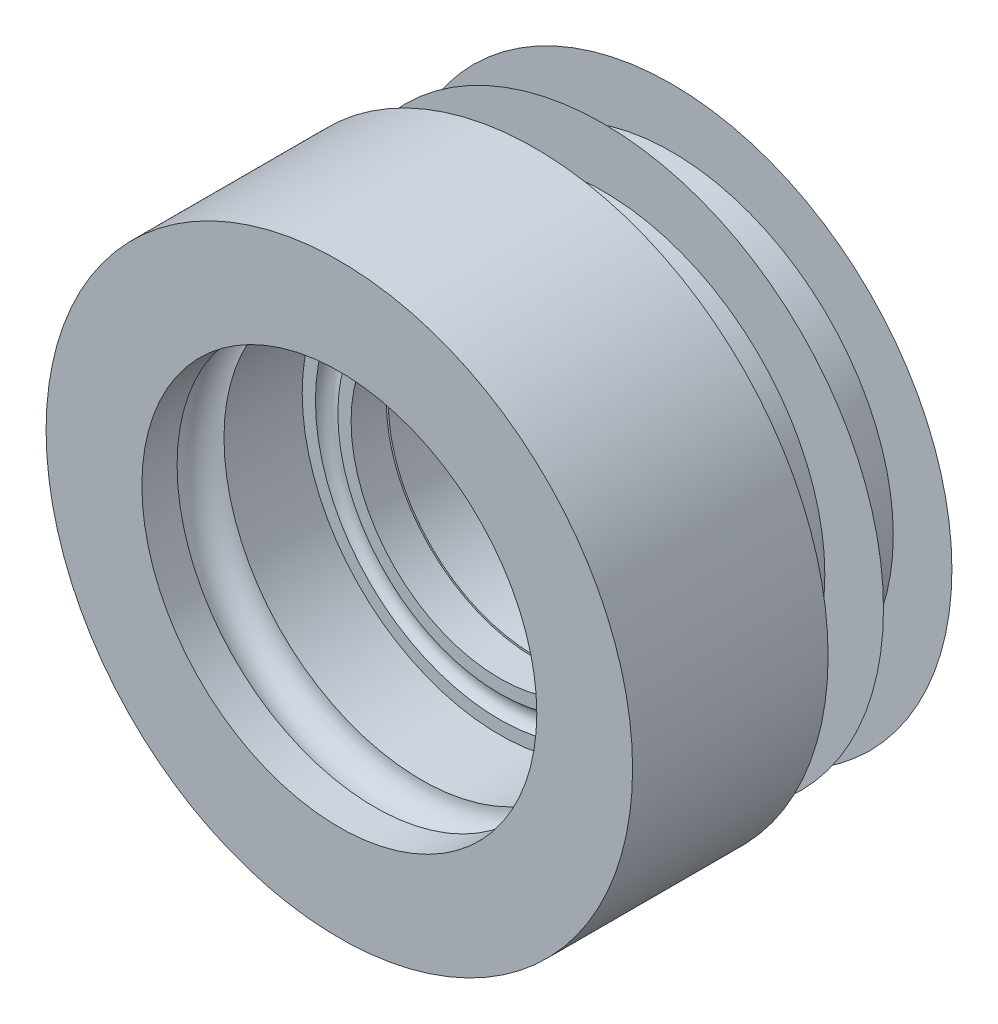
from build123d import *

# Parameters (mm, degrees)
SKETCH1_R           = 15
BOSS_EXTRUDE1_DEPTH = 10
SKETCH2_R           = 10.1
CUT_EXTRUDE1_DEPTH  = 24.452078799
SKETCH3_R           = 1.2
SKETCH5_W           = 11
SKETCH5_H           = 3.5
SKETCH7_R           = 0.625
SKETCH9_R           = 11.332657873
BOSS_EXTRUDE2_DEPTH = 9
SKETCH10_R          = 7.5
CUT_EXTRUDE2_DEPTH  = 29.478061732
LPATTERN1_COUNT     = 3
LPATTERN1_PITCH     = 3.5


with BuildPart() as part:
    # Sketch1 → Boss-Extrude1 (new body)
    with BuildSketch(Plane.XY):
        Circle(SKETCH1_R)
    extrude(amount=BOSS_EXTRUDE1_DEPTH)

    # Sketch2 → Cut-Extrude1 (cut, through all)
    with BuildSketch(Plane.XY.offset(10)):
        Circle(SKETCH2_R)
    extrude(amount=-CUT_EXTRUDE1_DEPTH, mode=Mode.SUBTRACT)

    # Sketch3 → Cut-Revolve2 (revolve, cut)
    with BuildSketch(Plane(origin=(0, 0, 0), x_dir=(0, 0, -1), z_dir=(1, 0, 0)), mode=Mode.PRIVATE) as cut_revolve2_sk:
        with Locations((-7, 10.1)):
            Circle(SKETCH3_R)
    revolve(cut_revolve2_sk.sketch.rotate(Axis((0, 0, 0), (0, 0, 1)), 270), axis=Axis((0, 0, 0), (0, 0, 1)), mode=Mode.SUBTRACT)

    # Sketch5 → Revolve1 (revolve)
    with BuildSketch(Plane(origin=(0, 0, 0), x_dir=(0, 0, -1), z_dir=(1, 0, 0)), mode=Mode.PRIVATE) as revolve1_sk:
        with Locations((3.7, -9.35)):
            Rectangle(SKETCH5_W, SKETCH5_H)
    revolve(revolve1_sk.sketch.rotate(Axis((0, 0, 0), (0, 0, 1)), 270), axis=Axis((0, 0, 0), (0, 0, 1)))

    # Sketch7 → Cut-Revolve3 (revolve, cut)
    with BuildSketch(Plane(origin=(0, 0, 0), x_dir=(0, 0, -1), z_dir=(1, 0, 0)), mode=Mode.PRIVATE) as cut_revolve3_sk:
        with Locations((-2.05, 8.85)):
            Circle(SKETCH7_R)
    revolve(cut_revolve3_sk.sketch.rotate(Axis((0, 0, 0), (0, 0, 1)), 90), axis=Axis((0, 0, 0), (0, 0, 1)), mode=Mode.SUBTRACT)

    # Sketch9 → Boss-Extrude2 (add)
    with BuildSketch(Plane(origin=(0, 0, 0), x_dir=(-1, 0, 0), z_dir=(0, 0, -1))):
        with Locations(Location((0, 0, 0), (0, 0, 180))):
            Circle(SKETCH9_R)
    extrude(amount=BOSS_EXTRUDE2_DEPTH)

    # Sketch10 → Cut-Extrude2 (cut, through all)
    with BuildSketch(Plane(origin=(0, 0, -9), x_dir=(-1, 0, 0), z_dir=(0, 0, -1))):
        Circle(SKETCH10_R)
    extrude(amount=-CUT_EXTRUDE2_DEPTH, mode=Mode.SUBTRACT)

    # Sketch11 → Revolve2 (revolve)
    with BuildSketch(Plane(origin=(0, 0, 0), x_dir=(0, 0, -1), z_dir=(1, 0, 0)), mode=Mode.PRIVATE) as revolve2_sk:
        Polygon((9, 11.332657873), (7, 11.332657873), (7, 14.332657873), align=None)
    revolve2 = revolve(revolve2_sk.sketch.rotate(Axis((0, 0, 0), (0, 0, 1)), 90), axis=Axis((0, 0, 0), (0, 0, 1)))

    # LPattern1: Revolve2 ×3
    with Locations(*[(0, 0, i * LPATTERN1_PITCH) for i in range(1, LPATTERN1_COUNT)]):
        add(revolve2)


solid = part.part
